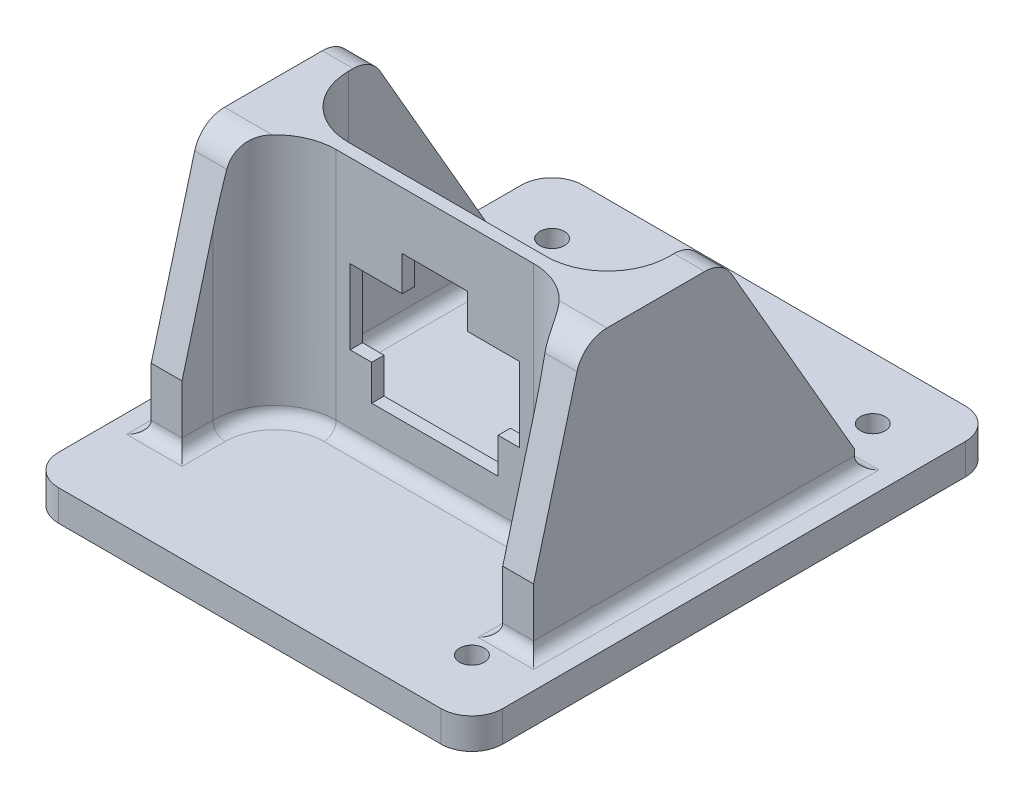
from build123d import *
from OCP.BRepFilletAPI import BRepFilletAPI_MakeChamfer

# Parameters (mm, degrees)
SKETCH1_W               = 72
SKETCH1_H               = 85
SKETCH1_R               = 2
BOSS_EXTRUDE1_DEPTH     = 5
BOSS_EXTRUDE2_DEPTH     = 40
CUT_EXTRUDE1_DEPTH      = 5
CUT_EXTRUDE_THIN1_DEPTH = 5
FILLET1_R               = 10
CHAMFER1_SIZE           = 37
CHAMFER1_SIZE2          = 21.36195996
CHAMFER2_SIZE           = 30
CHAMFER2_SIZE2          = 8.038475773
FILLET2_R               = 2
FILLET4_R               = 5


with BuildPart() as part:
    # Sketch1 → Boss-Extrude1 (new body)
    with BuildSketch(Plane(origin=(0, 0, 0), x_dir=(1, 0, 0), z_dir=(0, 1, 0))):
        with Locations((26, 32.5)):
            Rectangle(SKETCH1_W, SKETCH1_H)
        with Locations((0, 65)):
            Circle(SKETCH1_R, mode=Mode.SUBTRACT)
        with Locations((52, 65)):
            Circle(SKETCH1_R, mode=Mode.SUBTRACT)
        with Locations((52, 0)):
            Circle(SKETCH1_R, mode=Mode.SUBTRACT)
    extrude(amount=BOSS_EXTRUDE1_DEPTH)

    # Sketch2 → Boss-Extrude2 (add)
    with BuildSketch(Plane(origin=(0, 5, 0), x_dir=(1, 0, 0), z_dir=(0, 1, 0))):
        Polygon((-5, 5), (0, 5), (0, 20), (52, 20), (52, 5), (57, 5), (57, 57), (52, 57), (52, 22), (0, 22), (0, 57), (-5, 57), align=None)
    extrude(amount=BOSS_EXTRUDE2_DEPTH)

    # Sketch3 → Cut-Extrude1 (cut)
    with BuildSketch(Plane.XY.offset(-20)):
        Polygon((26, 35), (30.55, 35), (30.55, 29.35), (39, 29.35), (39, 18.75), (35.5, 18.75), (35.5, 13), (16.5, 13), (16.5, 18.75), (13, 18.75), (13, 29.35), (21.45, 29.35), (21.45, 35), align=None)
    extrude(amount=-CUT_EXTRUDE1_DEPTH, mode=Mode.SUBTRACT)

    # Sketch3<3> → Cut-Extrude-Thin1 (cut)
    with BuildSketch(Plane.XY.offset(-20)):
        Polygon((26, 35.75), (31.3, 35.75), (31.3, 30.1), (39.75, 30.1), (39.75, 18), (36.25, 18), (36.25, 12.25), (15.75, 12.25), (15.75, 18), (12.25, 18), (12.25, 30.1), (20.7, 30.1), (20.7, 35.75), align=None)
        Polygon((26, 35), (30.55, 35), (30.55, 29.35), (39, 29.35), (39, 18.75), (35.5, 18.75), (35.5, 13), (16.5, 13), (16.5, 18.75), (13, 18.75), (13, 29.35), (21.45, 29.35), (21.45, 35), align=None, mode=Mode.SUBTRACT)
    extrude(amount=-CUT_EXTRUDE_THIN1_DEPTH, mode=Mode.SUBTRACT)

    # Fillet1
    fillet1_edges = [part.edges().sort_by_distance(p)[0] for p in [
        (0, 25, -22),
        (52, 25, -22),
        (52, 25, -20),
        (0, 25, -20),
    ]]
    fillet(fillet1_edges, radius=FILLET1_R)

    # Chamfer1: one chamfer whose edges measure the first distance from different faces: ONE call of the kernel's chamfer builder (chamfer() names one face for all edges)
    chamfer1_edges_1 = [part.edges().sort_by_distance(p)[0] for p in [
        (-2.5, 45, -57),
    ]]
    chamfer1_side_1 = [part.faces().sort_by_distance(p)[0] for p in [
        (-2.5, 25, -57),
    ]]
    chamfer1_edges_2 = [part.edges().sort_by_distance(p)[0] for p in [
        (54.5, 45, -57),
    ]]
    chamfer1_side_2 = [part.faces().sort_by_distance(p)[0] for p in [
        (54.5, 25, -57),
    ]]
    chamfer1 = BRepFilletAPI_MakeChamfer(part.part.solid().wrapped)
    for e in chamfer1_edges_1:
        chamfer1.Add(CHAMFER1_SIZE, CHAMFER1_SIZE2, e.wrapped, chamfer1_side_1[0].wrapped)  # the first distance lies on this face
    for e in chamfer1_edges_2:
        chamfer1.Add(CHAMFER1_SIZE, CHAMFER1_SIZE2, e.wrapped, chamfer1_side_2[0].wrapped)  # the first distance lies on this face
    add(Compound.cast(chamfer1.Shape()), mode=Mode.REPLACE)

    # Chamfer2: one chamfer whose edges measure the first distance from different faces: ONE call of the kernel's chamfer builder (chamfer() names one face for all edges)
    chamfer2_edges_1 = [part.edges().sort_by_distance(p)[0] for p in [
        (54.5, 45, -5),
    ]]
    chamfer2_side_1 = [part.faces().sort_by_distance(p)[0] for p in [
        (54.5, 25, -5),
    ]]
    chamfer2_edges_2 = [part.edges().sort_by_distance(p)[0] for p in [
        (-2.5, 45, -5),
    ]]
    chamfer2_side_2 = [part.faces().sort_by_distance(p)[0] for p in [
        (-2.5, 25, -5),
    ]]
    chamfer2 = BRepFilletAPI_MakeChamfer(part.part.solid().wrapped)
    for e in chamfer2_edges_1:
        chamfer2.Add(CHAMFER2_SIZE, CHAMFER2_SIZE2, e.wrapped, chamfer2_side_1[0].wrapped)  # the first distance lies on this face
    for e in chamfer2_edges_2:
        chamfer2.Add(CHAMFER2_SIZE, CHAMFER2_SIZE2, e.wrapped, chamfer2_side_2[0].wrapped)  # the first distance lies on this face
    add(Compound.cast(chamfer2.Shape()), mode=Mode.REPLACE)

    # Fillet2
    fillet2_edges = [part.edges().sort_by_distance(p)[0] for p in [
        (54.5, 5, -57),
        (-2.5, 5, -57),
        (54.5, 5, -5),
        (-2.5, 5, -5),
        (0, 5, -44.5),
        (2.928932188, 5, -24.928932188),
        (26, 5, -22),
        (49.071067812, 5, -24.928932188),
        (52, 5, -7.5),
        (49.071067812, 5, -17.071067812),
        (26, 5, -20),
        (2.928932188, 5, -17.071067812),
        (52, 5, -44.5),
        (57, 5, -31),
        (0, 5, -7.5),
        (-5, 5, -31),
    ]]
    fillet(fillet2_edges, radius=FILLET2_R)

    # Fillet4
    fillet4_edges = [part.edges().sort_by_distance(p)[0] for p in [
        (-2.263603284, 45, -13.038475773),
        (54.263603284, 45, -13.038475773),
        (54.5, 45, -35.63804004),
        (-2.5, 45, -35.63804004),
        (62, 2.5, -75),
        (62, 2.5, 10),
        (-10, 2.5, -75),
        (-10, 2.5, 10),
    ]]
    fillet(fillet4_edges, radius=FILLET4_R)


solid = part.part
